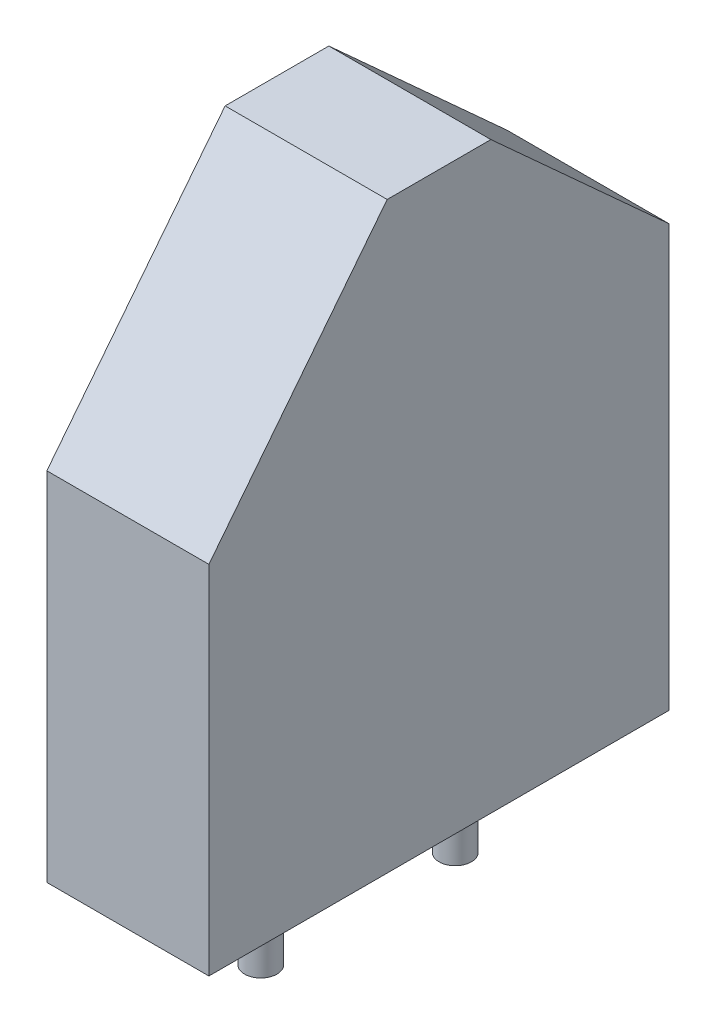
from build123d import *

# Parameters (mm, degrees)
SKETCH_1_W          = 5
SKETCH_1_H          = 14.2
EXTRUDE_1_DEPTH     = 18
SKETCH_2_R          = 0.5
EXTRUDE_2_DEPTH     = 3
CUT_EXTRUDE_1_DEPTH = 5


with BuildPart() as part:
    # 草图1 → 拉伸1 (new body)
    with BuildSketch(Plane(origin=(0, 0, 0), x_dir=(1, 0, 0), z_dir=(0, 1, 0))):
        Rectangle(SKETCH_1_W, SKETCH_1_H)
    extrude(amount=EXTRUDE_1_DEPTH)

    # 草图2 → 拉伸2 (add)
    with BuildSketch(Plane.XZ):
        with Locations(Location((0, 3, 0), (0, 0, 90))):
            Circle(SKETCH_2_R)
        with Locations(Location((0, -3, 0), (0, 0, 90))):
            Circle(SKETCH_2_R)
    extrude(amount=EXTRUDE_2_DEPTH)

    # 草图3 → 切除-拉伸1 (cut)
    with BuildSketch(Plane(origin=(2.5, 0, 0), x_dir=(0, 0, -1), z_dir=(1, 0, 0))):
        Polygon((-1.6, 18), (-7.1, 11), (-7.1, 18), align=None)
        Polygon((1.6, 18), (7.1, 13), (7.1, 18), align=None)
    extrude(amount=-CUT_EXTRUDE_1_DEPTH, mode=Mode.SUBTRACT)


solid = part.part
